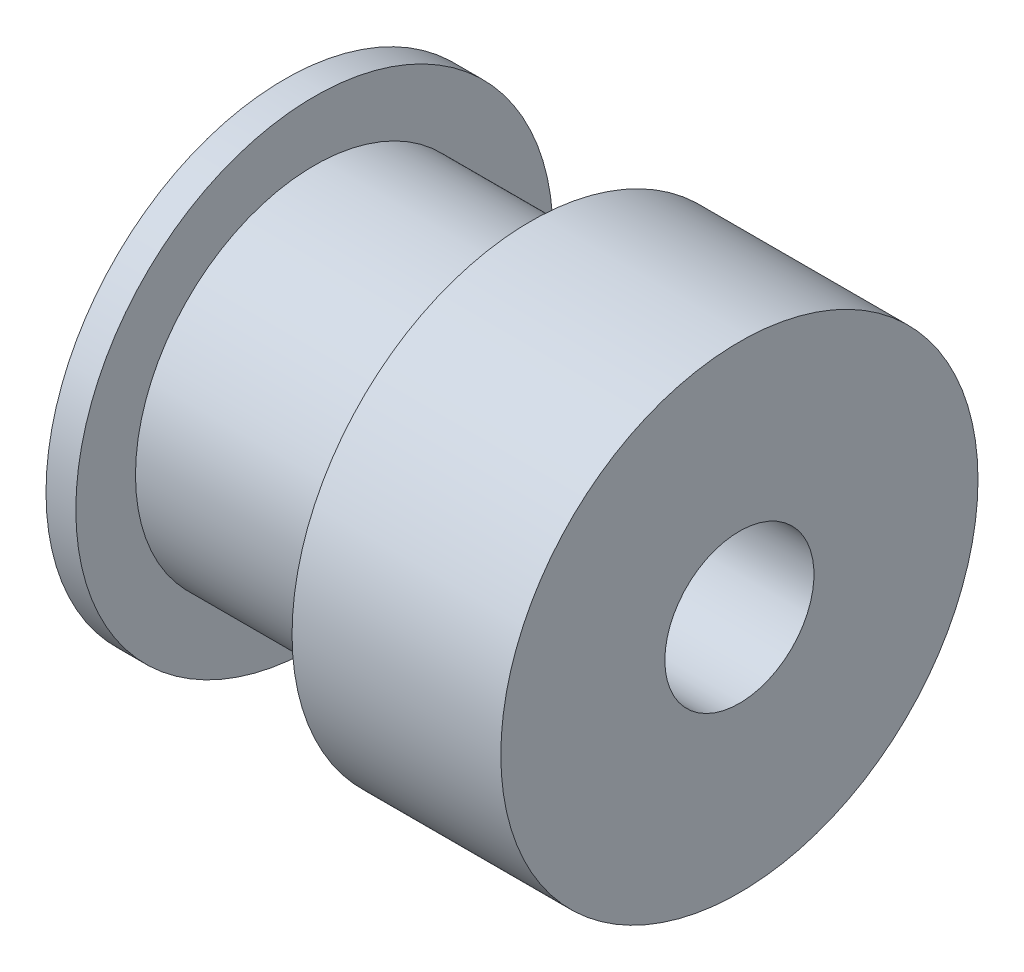
from build123d import *


with BuildPart() as part:
    # MainSketch → Revolve1 (revolve)
    with BuildSketch(Plane.XY, mode=Mode.PRIVATE) as revolve1_sk:
        Polygon((-7.625, 8), (-6.625, 8), (-6.625, 6), (0.625, 6), (0.625, 8), (7.625, 8), (7.625, 2.5), (-7.625, 2.5), align=None)
    revolve(revolve1_sk.sketch.rotate(Axis((-7.625, 0, 0), (1, 0, 0)), 90), axis=Axis((-7.625, 0, 0), (1, 0, 0)))


solid = part.part
